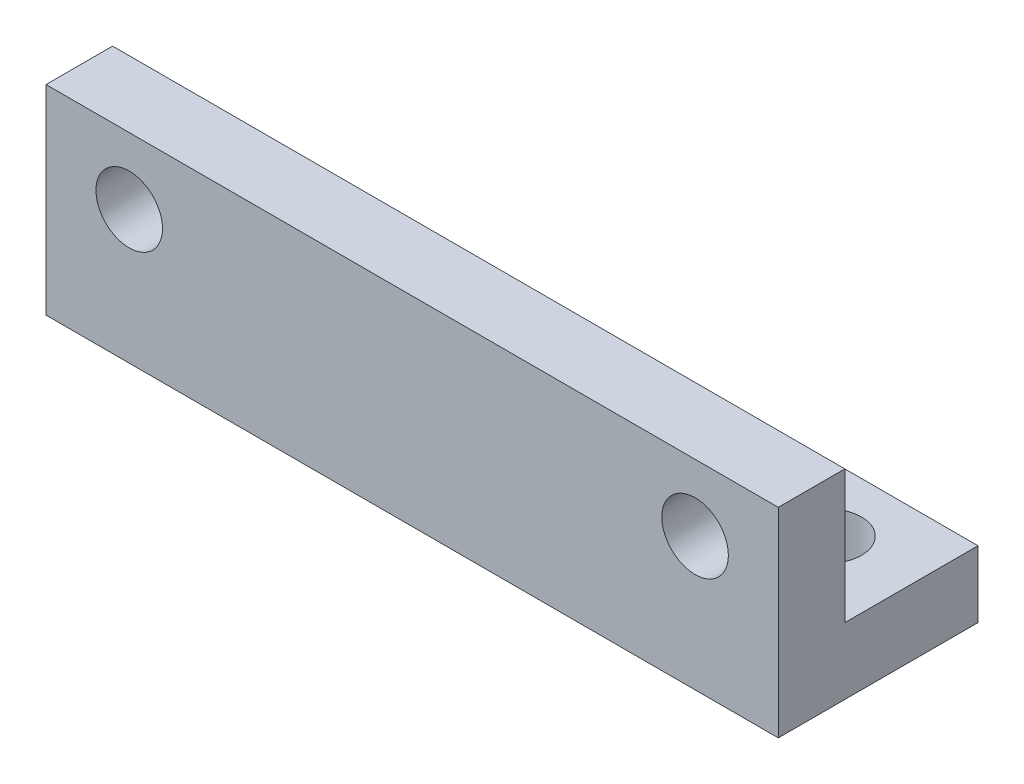
from build123d import *

# Parameters (mm, degrees)
EXTRUDE_1_DEPTH     = 11
CUT_EXTRUDE_1_REACH = 15.892
SKETCH_2_R          = 1
CUT_EXTRUDE_2_REACH = 15.892
SKETCH_3_R          = 1


with BuildPart() as part:
    # 草图1 → 凸台-拉伸1 (new, symmetric)
    with BuildSketch(Plane(origin=(0, 0, 0), x_dir=(0, 0, -1), z_dir=(1, 0, 0))):
        Polygon((0, 0), (0, 6), (2, 6), (2, 2), (6, 2), (6, 0), align=None)
    extrude(amount=EXTRUDE_1_DEPTH, both=True)

    # 草图2 → 切除-拉伸1 (cut, up to next)
    with BuildSketch(Plane.XY, mode=Mode.PRIVATE) as cut_extrude_1_sk1:
        with Locations((-8.5, 4)):
            Circle(SKETCH_2_R)
    cut_extrude_1_tool1 = extrude(cut_extrude_1_sk1.sketch, amount=-CUT_EXTRUDE_1_REACH, mode=Mode.PRIVATE) & part.part
    # 草图2 → 切除-拉伸1 (cut, up to next)
    with BuildSketch(Plane.XY, mode=Mode.PRIVATE) as cut_extrude_1_sk2:
        with Locations((8.5, 4)):
            Circle(SKETCH_2_R)
    cut_extrude_1_tool2 = extrude(cut_extrude_1_sk2.sketch, amount=-CUT_EXTRUDE_1_REACH, mode=Mode.PRIVATE) & part.part
    add(cut_extrude_1_tool1.solids().sort_by_distance((-8.5, 4, 0))[0], mode=Mode.SUBTRACT)
    add(cut_extrude_1_tool2.solids().sort_by_distance((8.5, 4, 0))[0], mode=Mode.SUBTRACT)

    # 草图3 → 切除-拉伸2 (cut, up to next)
    with BuildSketch(Plane.XZ, mode=Mode.PRIVATE) as cut_extrude_2_sk1:
        with Locations(Location((-8.5, -4, 0), (0, 0, 270))):
            Circle(SKETCH_3_R)
    cut_extrude_2_tool1 = extrude(cut_extrude_2_sk1.sketch, amount=-CUT_EXTRUDE_2_REACH, mode=Mode.PRIVATE) & part.part
    # 草图3 → 切除-拉伸2 (cut, up to next)
    with BuildSketch(Plane.XZ, mode=Mode.PRIVATE) as cut_extrude_2_sk2:
        with Locations(Location((8.5, -4, 0), (0, 0, 270))):
            Circle(SKETCH_3_R)
    cut_extrude_2_tool2 = extrude(cut_extrude_2_sk2.sketch, amount=-CUT_EXTRUDE_2_REACH, mode=Mode.PRIVATE) & part.part
    add(cut_extrude_2_tool1.solids().sort_by_distance((-8.5, 0, -4))[0], mode=Mode.SUBTRACT)
    add(cut_extrude_2_tool2.solids().sort_by_distance((8.5, 0, -4))[0], mode=Mode.SUBTRACT)


solid = part.part
